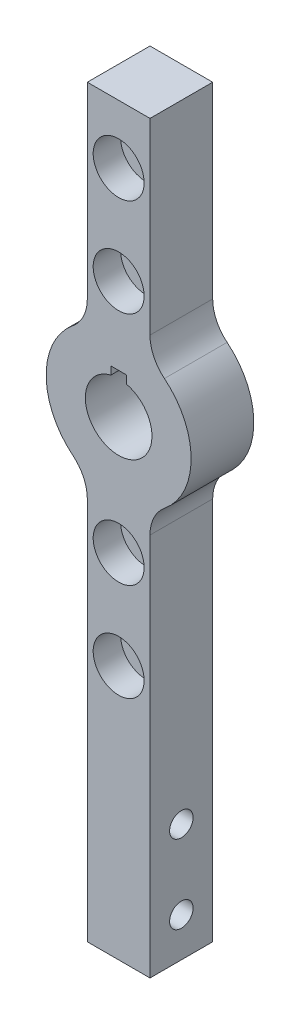
from build123d import *

# Parameters (mm, degrees)
SKETCH1_R           = 18.5
SKETCH1_R_2         = 8.5
BOSS_EXTRUDE1_DEPTH = 8
SKETCH2_W           = 16
SKETCH2_H           = 53.319172682
BOSS_EXTRUDE2_DEPTH = 8
SKETCH3_W           = 16
SKETCH3_H           = 103.319172682
BOSS_EXTRUDE3_DEPTH = 8
SKETCH4_W           = 4
SKETCH4_H           = 2.038644179
CUT_EXTRUDE1_DEPTH  = 123.467342586
FILLET1_R           = 10
SKETCH7_R           = 6.5
CUT_EXTRUDE3_DEPTH  = 7
SKETCH8_R           = 3
CUT_EXTRUDE4_DEPTH  = 122.750770018
SKETCH9_R           = 3
CUT_EXTRUDE5_DEPTH  = 124.151329672


with BuildPart() as part:
    # Sketch1 → Boss-Extrude1 (new, symmetric)
    with BuildSketch(Plane.XY):
        Circle(SKETCH1_R)
        Circle(SKETCH1_R_2, mode=Mode.SUBTRACT)
    extrude(amount=BOSS_EXTRUDE1_DEPTH, both=True)

    # Sketch2 → Boss-Extrude2 (add, symmetric)
    with BuildSketch(Plane.XY):
        with Locations((0, 43.340413659)):
            Rectangle(SKETCH2_W, SKETCH2_H)
    extrude(amount=BOSS_EXTRUDE2_DEPTH, both=True)

    # Sketch3 → Boss-Extrude3 (add, symmetric)
    with BuildSketch(Plane.XY):
        with Locations((0, -68.340413659)):
            Rectangle(SKETCH3_W, SKETCH3_H)
    extrude(amount=BOSS_EXTRUDE3_DEPTH, both=True)

    # Sketch4 → Cut-Extrude1 (cut, through all)
    with BuildSketch(Plane(origin=(0, 0, -8), x_dir=(-1, 0, 0), z_dir=(0, 0, -1))):
        with Locations((0, 9.28067791)):
            Rectangle(SKETCH4_W, SKETCH4_H)
    extrude(amount=-CUT_EXTRUDE1_DEPTH, mode=Mode.SUBTRACT)

    # Fillet1
    fillet1_edges = [part.edges().sort_by_distance(p)[0] for p in [
        (8, 16.680827318, 0),
        (-8, 16.680827318, 0),
        (8, -16.680827318, 0),
        (-8, -16.680827318, 0),
    ]]
    fillet(fillet1_edges, radius=FILLET1_R)

    # Sketch7 → Cut-Extrude3 (cut)
    with BuildSketch(Plane.XY.offset(8)):
        with Locations((0, 55)):
            Circle(SKETCH7_R)
        with Locations((0, 30)):
            Circle(SKETCH7_R)
    cut_extrude3 = extrude(amount=-CUT_EXTRUDE3_DEPTH, mode=Mode.SUBTRACT)

    # Mirror1: Cut-Extrude3 across plane
    add(cut_extrude3.mirror(Plane.ZX), mode=Mode.SUBTRACT)

    # Sketch8 → Cut-Extrude4 (cut, through all)
    with BuildSketch(Plane.XY.offset(1)):
        with Locations((0, 55)):
            Circle(SKETCH8_R)
        with Locations((0, 30)):
            Circle(SKETCH8_R)
    cut_extrude4 = extrude(amount=-CUT_EXTRUDE4_DEPTH, mode=Mode.SUBTRACT)

    # Mirror2: Cut-Extrude4 across plane
    add(cut_extrude4.mirror(Plane.ZX), mode=Mode.SUBTRACT)

    # Sketch9 → Cut-Extrude5 (cut, through all)
    with BuildSketch(Plane(origin=(8, 0, 0), x_dir=(0, 0, -1), z_dir=(1, 0, 0))):
        with Locations(Location((0, -110, 0), (0, 0, 90))):
            Circle(SKETCH9_R)
        with Locations(Location((0, -90, 0), (0, 0, 90))):
            Circle(SKETCH9_R)
    extrude(amount=-CUT_EXTRUDE5_DEPTH, mode=Mode.SUBTRACT)


solid = part.part
